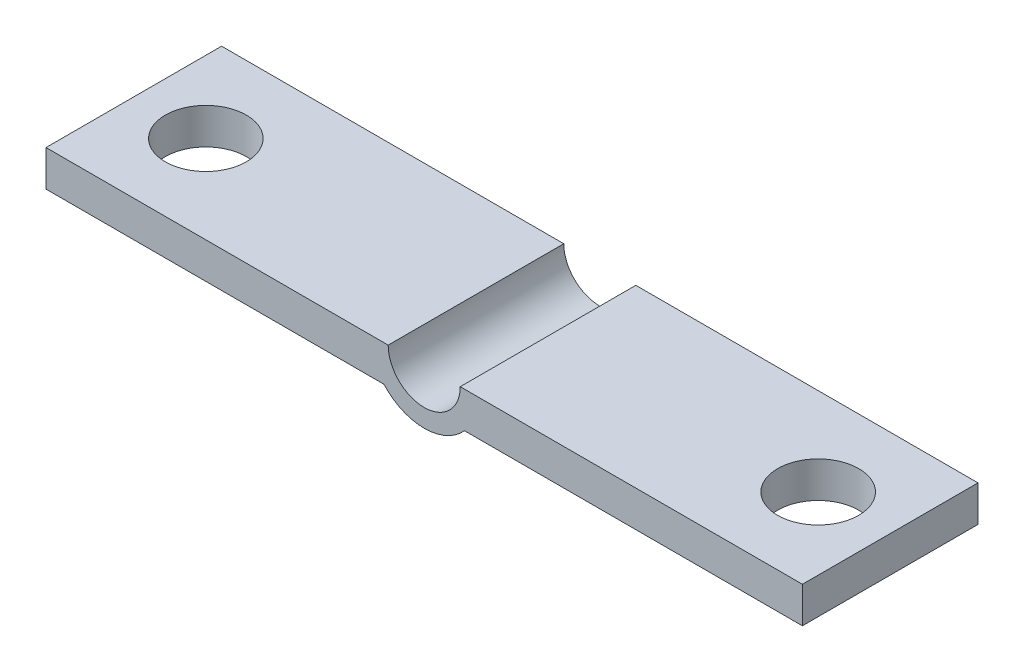
from build123d import *

# Parameters (mm, degrees)
EXTRUDE_THIN1_DEPTH = 9.75
SKETCH3_W           = 19
SKETCH3_H           = 9.75
BOSS_EXTRUDE1_DEPTH = 2
SKETCH4_R           = 2.25
CUT_EXTRUDE1_DEPTH  = 24.346573624


with BuildPart() as part:
    # Sketch1 → Extrude-Thin1 (new body)
    with BuildSketch(Plane.XY):
        with BuildLine():
            ThreePointArc((-2, 0), (0, -2), (2, 0))
            Line((2, 0), (3, 0))
            ThreePointArc((3, 0), (0, -3), (-3, 0))
            Line((-3, 0), (-2, 0))
        make_face()
    extrude(amount=EXTRUDE_THIN1_DEPTH)

    # Sketch3 → Boss-Extrude1 (add)
    with BuildSketch(Plane(origin=(0, 0, 0), x_dir=(1, 0, 0), z_dir=(0, 1, 0))):
        with Locations((-11.5, -4.875)):
            Rectangle(SKETCH3_W, SKETCH3_H)
        with Locations((11.5, -4.875)):
            Rectangle(SKETCH3_W, SKETCH3_H)
    extrude(amount=-BOSS_EXTRUDE1_DEPTH)

    # Sketch4 → Cut-Extrude1 (cut, through all)
    with BuildSketch(Plane(origin=(0, 0, 0), x_dir=(1, 0, 0), z_dir=(0, 1, 0))):
        with Locations(Location((-17, -4.875, 0), (0, 0, 180))):
            Circle(SKETCH4_R)
        with Locations((17, -4.875)):
            Circle(SKETCH4_R)
    extrude(amount=-CUT_EXTRUDE1_DEPTH, mode=Mode.SUBTRACT)


solid = part.part
